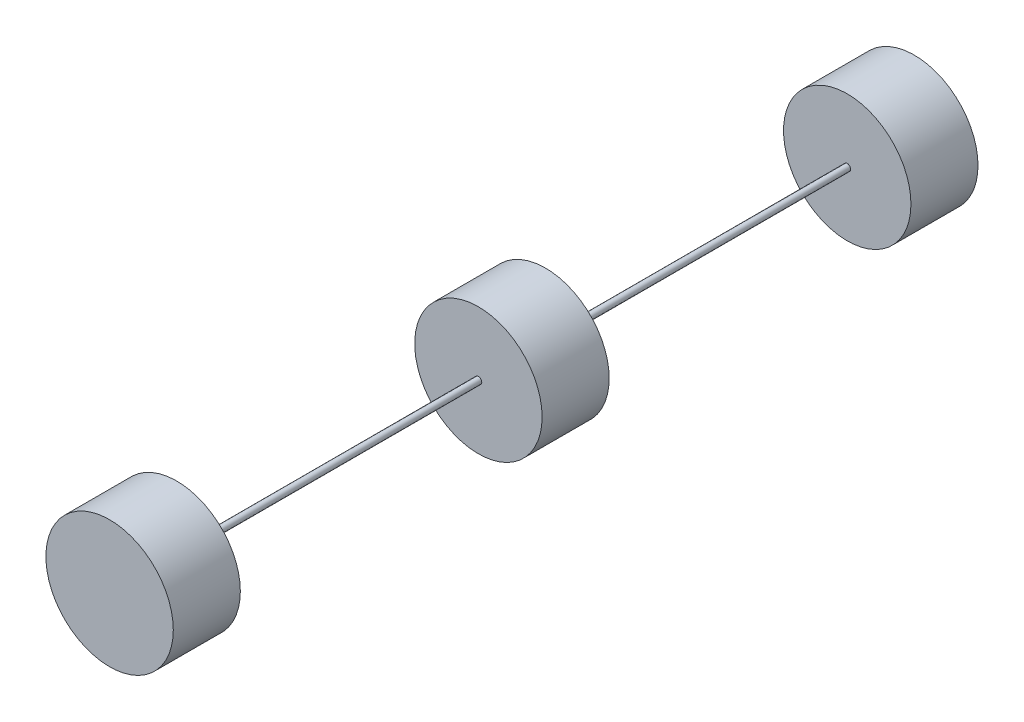
from build123d import *

# Parameters (mm, degrees)
SKETCH_1_R      = 19
EXTRUDE_1_DEPTH = 20
SKETCH_2_R      = 1
EXTRUDE_2_DEPTH = 90
SKETCH_3_R      = 19
EXTRUDE_3_DEPTH = 20
SKETCH_4_R      = 1
EXTRUDE_4_DEPTH = 90
SKETCH_5_R      = 19
EXTRUDE_5_DEPTH = 20


with BuildPart() as part:
    # 草图1 → 凸台-拉伸1 (new body)
    with BuildSketch(Plane.XY):
        Circle(SKETCH_1_R)
    extrude(amount=EXTRUDE_1_DEPTH)

    # 草图2 → 凸台-拉伸2 (add)
    with BuildSketch(Plane.XY.offset(20)):
        with Locations(Location((0, 0, 0), (0, 0, 180))):
            Circle(SKETCH_2_R)
    extrude(amount=EXTRUDE_2_DEPTH)

    # 草图3 → 凸台-拉伸3 (add)
    with BuildSketch(Plane.XY.offset(110)):
        Circle(SKETCH_3_R)
    extrude(amount=EXTRUDE_3_DEPTH)

    # 草图4 → 凸台-拉伸4 (add)
    with BuildSketch(Plane.XY.offset(130)):
        with Locations(Location((0, 0, 0), (0, 0, 180))):
            Circle(SKETCH_4_R)
    extrude(amount=EXTRUDE_4_DEPTH)

    # 草图5 → 凸台-拉伸5 (add)
    with BuildSketch(Plane.XY.offset(220)):
        Circle(SKETCH_5_R)
    extrude(amount=EXTRUDE_5_DEPTH)


solid = part.part
